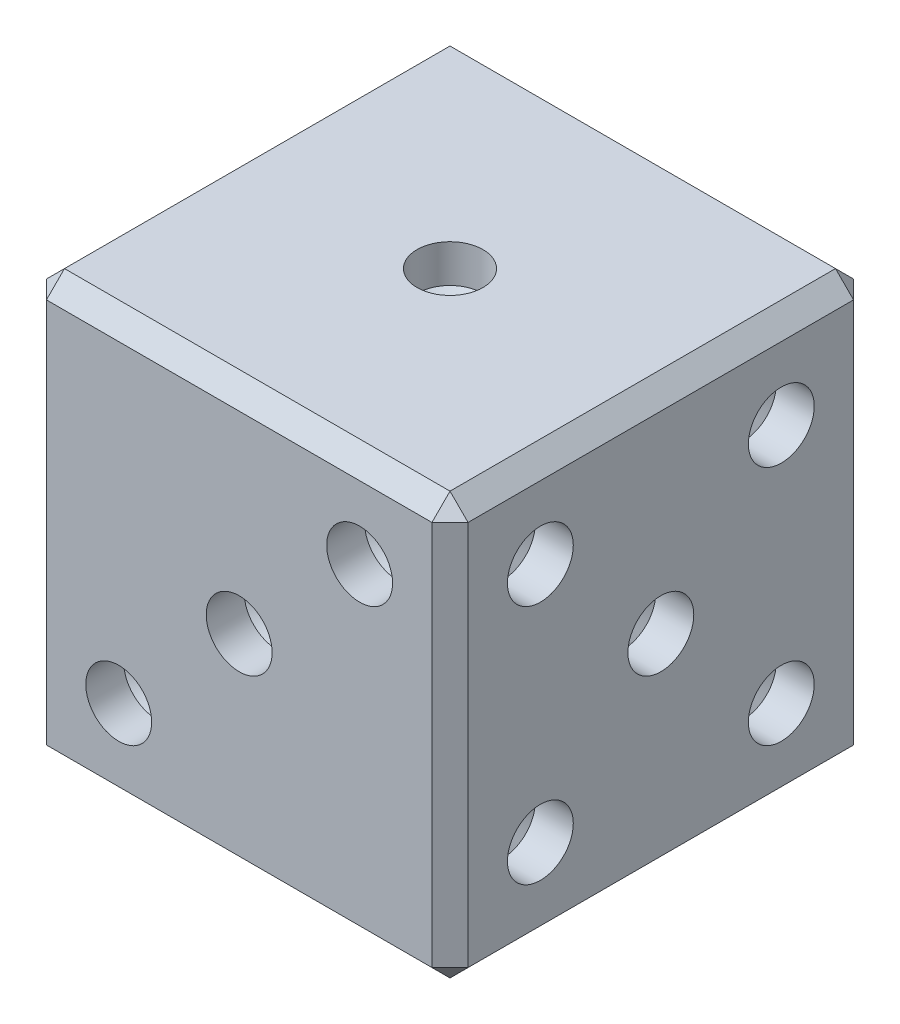
from build123d import *

# Parameters (mm, degrees)
SKETCH1_W                           = 17.78
SKETCH1_H                           = 17.78
BOSS_EXTRUDE1_DEPTH                 = 8.89
CHAMFER1_SIZE                       = 0.762
F_7_64_0_10938_DIAMETER_HOLE1_D     = 2.778252
F_7_64_0_10938_DIAMETER_HOLE1_DEPTH = 1.6002
F_7_64_0_10938_DIAMETER_HOLE1_TIP   = 0.834671108
F_7_64_0_10938_DIAMETER_HOLE2_D     = 2.778252
F_7_64_0_10938_DIAMETER_HOLE2_DEPTH = 1.6002
F_7_64_0_10938_DIAMETER_HOLE2_TIP   = 0.834671108
F_7_64_0_10938_DIAMETER_HOLE3_D     = 2.778252
F_7_64_0_10938_DIAMETER_HOLE3_DEPTH = 1.6002
F_7_64_0_10938_DIAMETER_HOLE3_TIP   = 0.834671108
F_7_64_0_10938_DIAMETER_HOLE5_D     = 2.778252
F_7_64_0_10938_DIAMETER_HOLE5_DEPTH = 1.6002
F_7_64_0_10938_DIAMETER_HOLE5_TIP   = 0.834671108
F_7_64_0_10938_DIAMETER_HOLE6_D     = 2.778252
F_7_64_0_10938_DIAMETER_HOLE6_DEPTH = 1.6002
F_7_64_0_10938_DIAMETER_HOLE6_TIP   = 0.834671108
F_7_64_0_10938_DIAMETER_HOLE7_D     = 2.778252
F_7_64_0_10938_DIAMETER_HOLE7_DEPTH = 1.6002
F_7_64_0_10938_DIAMETER_HOLE7_TIP   = 0.834671108


with BuildPart() as part:
    # Sketch1 → Boss-Extrude1 (new, symmetric)
    with BuildSketch(Plane(origin=(0, 0, 0), x_dir=(1, 0, 0), z_dir=(0, 1, 0))):
        Rectangle(SKETCH1_W, SKETCH1_H)
    extrude(amount=BOSS_EXTRUDE1_DEPTH, both=True)

    # Chamfer1
    chamfer1_edges = [part.edges().sort_by_distance(p)[0] for p in [
        (0, 8.89, 8.89),
        (-8.89, 8.89, 0),
        (0, 8.89, -8.89),
        (-8.89, -8.89, 0),
        (0, -8.89, 8.89),
        (8.89, -8.89, 0),
        (0, -8.89, -8.89),
        (8.89, 8.89, 0),
        (-8.89, 0, -8.89),
        (-8.89, 0, 8.89),
        (8.89, 0, 8.89),
        (8.89, 0, -8.89),
    ]]
    chamfer(chamfer1_edges, length=CHAMFER1_SIZE)

    # 7/64 (0.10938) Diameter Hole1
    with Locations(Plane(origin=(0, 8.89, 0), x_dir=(1, 0, 0), z_dir=(0, 1, 0))):
        with Locations((0, 0)):
            Hole(F_7_64_0_10938_DIAMETER_HOLE1_D / 2, depth=F_7_64_0_10938_DIAMETER_HOLE1_DEPTH)
            with Locations((0, 0, -(F_7_64_0_10938_DIAMETER_HOLE1_DEPTH + F_7_64_0_10938_DIAMETER_HOLE1_TIP / 2))):  # 118° drill point
                Cone(0, F_7_64_0_10938_DIAMETER_HOLE1_D / 2, F_7_64_0_10938_DIAMETER_HOLE1_TIP, mode=Mode.SUBTRACT)

    # 7/64 (0.10938) Diameter Hole2
    with Locations(Plane(origin=(0, -8.89, 0), x_dir=(-1, 0, 0), z_dir=(0, -1, 0))):
        with Locations((5.08, -5.08), (5.08, 0), (5.08, 5.08), (-5.08, 5.08), (-5.08, 0), (-5.08, -5.08)):
            Hole(F_7_64_0_10938_DIAMETER_HOLE2_D / 2, depth=F_7_64_0_10938_DIAMETER_HOLE2_DEPTH)
            with Locations((0, 0, -(F_7_64_0_10938_DIAMETER_HOLE2_DEPTH + F_7_64_0_10938_DIAMETER_HOLE2_TIP / 2))):  # 118° drill point
                Cone(0, F_7_64_0_10938_DIAMETER_HOLE2_D / 2, F_7_64_0_10938_DIAMETER_HOLE2_TIP, mode=Mode.SUBTRACT)

    # 7/64 (0.10938) Diameter Hole3
    with Locations(Plane.XY.offset(8.89)):
        with Locations((-5.08, -5.08), (0, 0), (5.08, 5.08)):
            Hole(F_7_64_0_10938_DIAMETER_HOLE3_D / 2, depth=F_7_64_0_10938_DIAMETER_HOLE3_DEPTH)
            with Locations((0, 0, -(F_7_64_0_10938_DIAMETER_HOLE3_DEPTH + F_7_64_0_10938_DIAMETER_HOLE3_TIP / 2))):  # 118° drill point
                Cone(0, F_7_64_0_10938_DIAMETER_HOLE3_D / 2, F_7_64_0_10938_DIAMETER_HOLE3_TIP, mode=Mode.SUBTRACT)

    # 7/64 (0.10938) Diameter Hole5
    with Locations(Plane.ZY.offset(8.89)):
        with Locations((-5.08, 5.08), (5.08, -5.08)):
            Hole(F_7_64_0_10938_DIAMETER_HOLE5_D / 2, depth=F_7_64_0_10938_DIAMETER_HOLE5_DEPTH)
            with Locations((0, 0, -(F_7_64_0_10938_DIAMETER_HOLE5_DEPTH + F_7_64_0_10938_DIAMETER_HOLE5_TIP / 2))):  # 118° drill point
                Cone(0, F_7_64_0_10938_DIAMETER_HOLE5_D / 2, F_7_64_0_10938_DIAMETER_HOLE5_TIP, mode=Mode.SUBTRACT)

    # 7/64 (0.10938) Diameter Hole6
    with Locations(Plane(origin=(8.89, 0, 0), x_dir=(0, 0, -1), z_dir=(1, 0, 0))):
        with Locations((-5.08, 5.08), (-5.08, -5.08), (5.08, -5.08), (5.08, 5.08), (0, 0)):
            Hole(F_7_64_0_10938_DIAMETER_HOLE6_D / 2, depth=F_7_64_0_10938_DIAMETER_HOLE6_DEPTH)
            with Locations((0, 0, -(F_7_64_0_10938_DIAMETER_HOLE6_DEPTH + F_7_64_0_10938_DIAMETER_HOLE6_TIP / 2))):  # 118° drill point
                Cone(0, F_7_64_0_10938_DIAMETER_HOLE6_D / 2, F_7_64_0_10938_DIAMETER_HOLE6_TIP, mode=Mode.SUBTRACT)

    # 7/64 (0.10938) Diameter Hole7
    with Locations(Plane(origin=(0, 0, -8.89), x_dir=(-1, 0, 0), z_dir=(0, 0, -1))):
        with Locations((-5.08, 5.08), (-5.08, -5.08), (5.08, -5.08), (5.08, 5.08)):
            Hole(F_7_64_0_10938_DIAMETER_HOLE7_D / 2, depth=F_7_64_0_10938_DIAMETER_HOLE7_DEPTH)
            with Locations((0, 0, -(F_7_64_0_10938_DIAMETER_HOLE7_DEPTH + F_7_64_0_10938_DIAMETER_HOLE7_TIP / 2))):  # 118° drill point
                Cone(0, F_7_64_0_10938_DIAMETER_HOLE7_D / 2, F_7_64_0_10938_DIAMETER_HOLE7_TIP, mode=Mode.SUBTRACT)


solid = part.part
